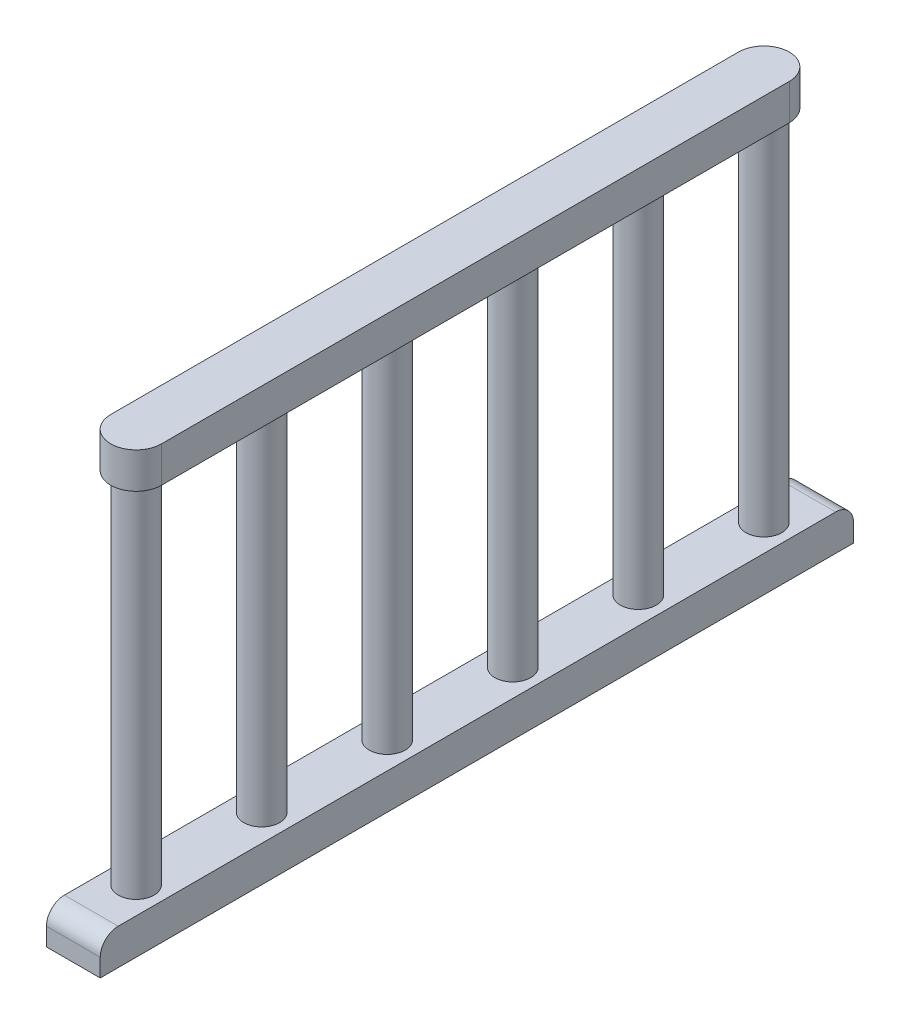
from build123d import *

# Parameters (mm, degrees)
SKETCH2_W               = 150
SKETCH2_H               = 2100
BOSS_EXTRUDE3_DEPTH     = 100
BOSS_EXTRUDE3_2_DEPTH   = 100
SKETCH3_R               = 50
BOSS_EXTRUDE4_DEPTH     = 1000
LPATTERN1_COUNT         = 6
LPATTERN1_PITCH         = 350
SKETCH5_R               = 50
BOSS_EXTRUDE5_DEPTH     = 1000
LPATTERN2_COUNT         = 6
LPATTERN2_PITCH         = 350
FILLET1_R               = 50
FILLET2_R               = 50
FILLET3_R               = 50
FILLET4_R               = 50
BOSS_EXTRUDE8_DEPTH     = 100
CUT_EXTRUDE1_DEPTH      = 2000
CUT_EXTRUDE1_DEPTH_BACK = 2000
SKETCH14_W              = 805.257541721
SKETCH14_H              = 2502.966116942


with BuildPart() as part:
    # Sketch2 → Boss-Extrude3 (new body)
    with BuildSketch(Plane(origin=(0, 0, 0), x_dir=(1, 0, 0), z_dir=(0, 1, 0))):
        with Locations((1775, 1037.975951904)):
            Rectangle(SKETCH2_W, SKETCH2_H)
    extrude(amount=BOSS_EXTRUDE3_DEPTH)

    # Sketch5 → Boss-Extrude5 (add)
    with BuildSketch(Plane(origin=(0, 100, 0), x_dir=(1, 0, 0), z_dir=(0, 1, 0))):
        with Locations(Location((1775, 1912.975951904, 0), (0, 0, 270))):
            Circle(SKETCH5_R)
    boss_extrude5 = extrude(amount=BOSS_EXTRUDE5_DEPTH)

    # LPattern2: Boss-Extrude5 ×6
    with Locations(*[(0, 0, i * LPATTERN2_PITCH) for i in range(1, LPATTERN2_COUNT)]):
        add(boss_extrude5)

    # Fillet3
    fillet3_edges = [part.edges().sort_by_distance(p)[0] for p in [
        (1775, 100, 12.024048096),
    ]]
    fillet(fillet3_edges, radius=FILLET3_R)

    # Fillet4
    fillet4_edges = [part.edges().sort_by_distance(p)[0] for p in [
        (1775, 100, -2087.975951904),
    ]]
    fillet(fillet4_edges, radius=FILLET4_R)



with BuildPart() as body_2:
    # Sketch2 → Boss-Extrude3 2 (new body)
    with BuildSketch(Plane(origin=(0, 0, 0), x_dir=(1, 0, 0), z_dir=(0, 1, 0))):
        with Locations((-1775, 1037.975951904)):
            Rectangle(SKETCH2_W, SKETCH2_H)
    extrude(amount=BOSS_EXTRUDE3_2_DEPTH)

    # Sketch3 → Boss-Extrude4 (add)
    with BuildSketch(Plane(origin=(0, 100, 0), x_dir=(1, 0, 0), z_dir=(0, 1, 0))):
        with Locations(Location((-1775, 162.975951904, 0), (0, 0, 90))):
            Circle(SKETCH3_R)
    boss_extrude4 = extrude(amount=BOSS_EXTRUDE4_DEPTH)

    # LPattern1: Boss-Extrude4 ×6
    with Locations(*[(0, 0, -i * LPATTERN1_PITCH) for i in range(1, LPATTERN1_COUNT)]):
        add(boss_extrude4)

    # Fillet1
    fillet1_edges = [body_2.edges().sort_by_distance(p)[0] for p in [
        (-1775, 100, -2087.975951904),
    ]]
    fillet(fillet1_edges, radius=FILLET1_R)

    # Fillet2
    fillet2_edges = [body_2.edges().sort_by_distance(p)[0] for p in [
        (-1775, 100, 12.024048096),
    ]]
    fillet(fillet2_edges, radius=FILLET2_R)


with BuildPart() as part_1:
    add(part.part)

    add(body_2.part)  # Boss-Extrude8 merges body 2
    # Sketch13 → Boss-Extrude8 (add)
    with BuildSketch(Plane(origin=(0, 1100, 0), x_dir=(1, 0, 0), z_dir=(0, 1, 0))):
        with BuildLine():
            Line((-1845.838339321, 162.975951904), (-1845.838339321, 1912.975951904))
            ThreePointArc((-1845.838339321, 1912.975951904), (-1775, 1983.814291225), (-1704.161660679, 1912.975951904))
            Line((-1704.161660679, 1912.975951904), (-1704.161660679, 162.975951904))
            ThreePointArc((-1704.161660679, 162.975951904), (-1775, 92.137612583), (-1845.838339321, 162.975951904))
        make_face()
        with BuildLine():
            Line((1845.838339321, 162.975951904), (1845.838339321, 1912.975951904))
            ThreePointArc((1845.838339321, 1912.975951904), (1775, 1983.814291225), (1704.161660679, 1912.975951904))
            Line((1704.161660679, 1912.975951904), (1704.161660679, 162.975951904))
            ThreePointArc((1704.161660679, 162.975951904), (1775, 92.137612583), (1845.838339321, 162.975951904))
        make_face()
    extrude(amount=BOSS_EXTRUDE8_DEPTH)

    # Sketch14 → Cut-Extrude1 (cut, two sides: drawn at the far end of the back side and taken through both)
    with BuildSketch(Plane(origin=(0, 1100, 0), x_dir=(1, 0, 0), z_dir=(0, 1, 0)).offset(-CUT_EXTRUDE1_DEPTH_BACK)):
        with Locations((-1496.523875696, 935.395373341)):
            Rectangle(SKETCH14_W, SKETCH14_H)
    extrude(amount=CUT_EXTRUDE1_DEPTH + CUT_EXTRUDE1_DEPTH_BACK, mode=Mode.SUBTRACT)


solid = part_1.part
